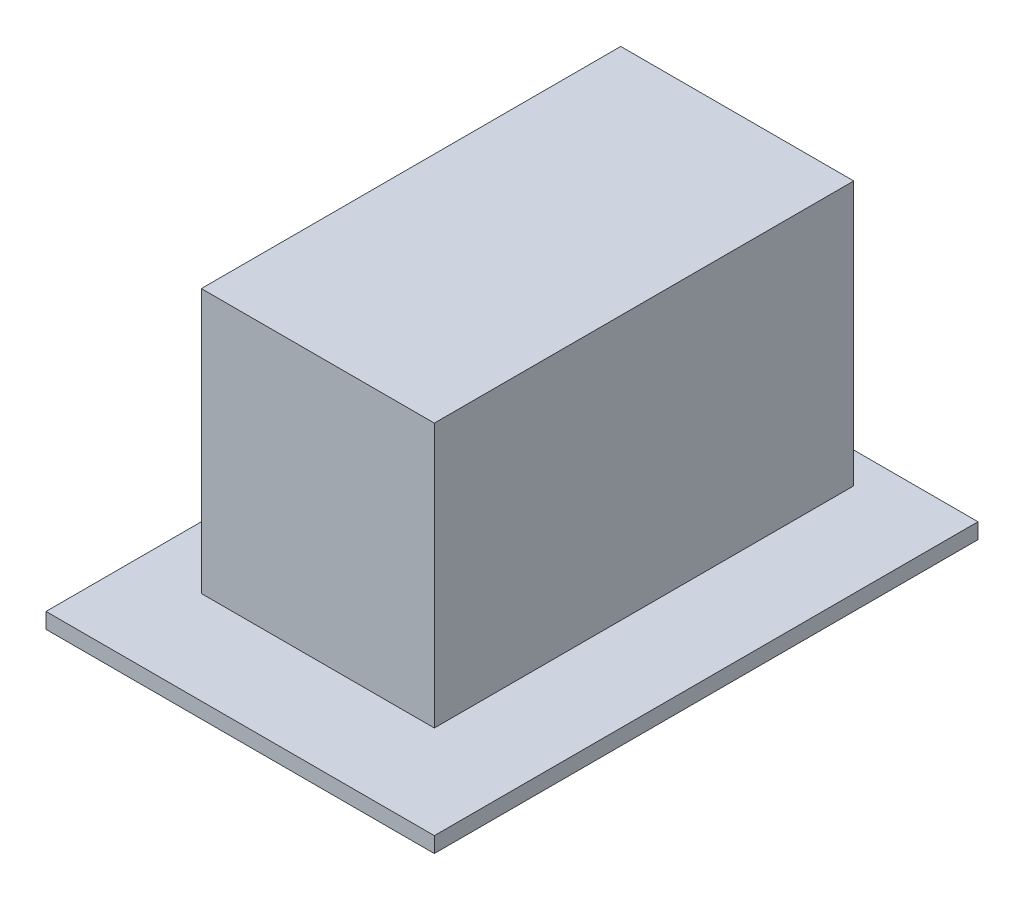
from build123d import *

# Parameters (mm, degrees)
ESBO_O1_W                = 25
ESBO_O1_H                = 35
RESSALTO_EXTRUS_O1_DEPTH = 1
ESBO_O2_W                = 15
ESBO_O2_H                = 27
RESSALTO_EXTRUS_O2_DEPTH = 17


with BuildPart() as part:
    # Esboço1 → Ressalto-extrusão1 (new body)
    with BuildSketch(Plane(origin=(0, 0, 0), x_dir=(1, 0, 0), z_dir=(0, 1, 0))):
        Rectangle(ESBO_O1_W, ESBO_O1_H)
    extrude(amount=RESSALTO_EXTRUS_O1_DEPTH)

    # Esboço2 → Ressalto-extrusão2 (add)
    with BuildSketch(Plane(origin=(0, 1, 0), x_dir=(1, 0, 0), z_dir=(0, 1, 0))):
        with Locations((-1, 2)):
            Rectangle(ESBO_O2_W, ESBO_O2_H)
    extrude(amount=RESSALTO_EXTRUS_O2_DEPTH)


solid = part.part
